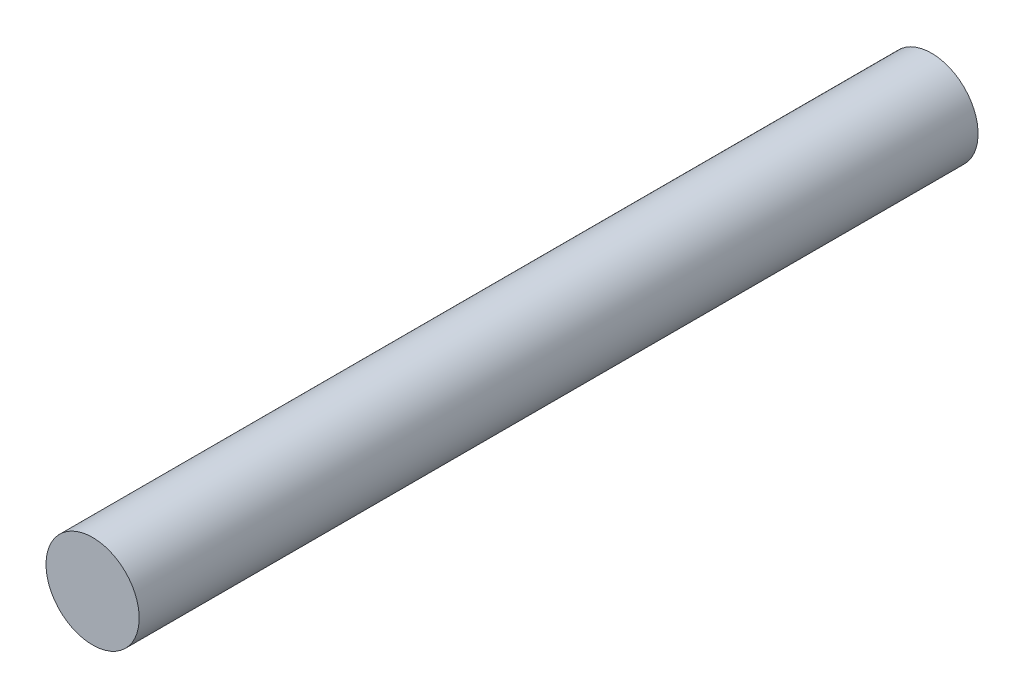
from build123d import *

# Parameters (mm, degrees)
SKETCH1_R           = 12.7
BOSS_EXTRUDE1_DEPTH = 228.6


with BuildPart() as part:
    # Sketch1 → Boss-Extrude1 (new body)
    with BuildSketch(Plane.XY):
        with Locations(Location((0, 0, 0), (0, 0, 180))):
            Circle(SKETCH1_R)
    extrude(amount=BOSS_EXTRUDE1_DEPTH)


solid = part.part
